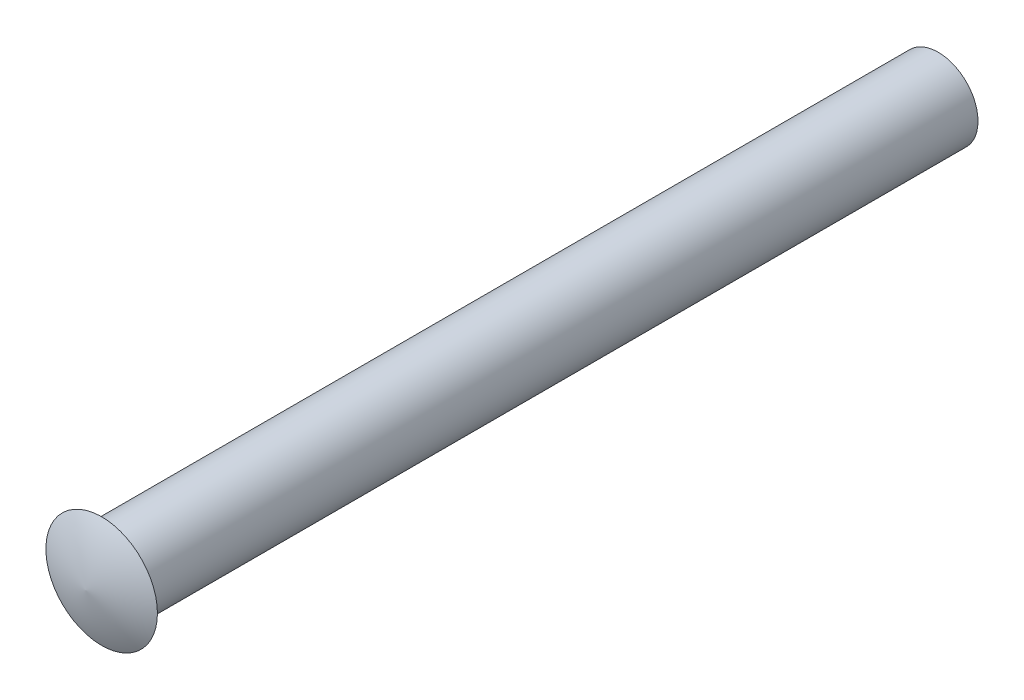
from build123d import *


with BuildPart() as part:
    # Sketch2 → Revolve1 (revolve)
    with BuildSketch(Plane(origin=(0, 0, 0), x_dir=(0, 0, -1), z_dir=(1, 0, 0)), mode=Mode.PRIVATE) as revolve1_sk:
        with BuildLine():
            Line((0.1, 0.35), (0.1, 0.25))
            Line((0.1, 0.25), (5.35, 0.25))
            Line((5.35, 0.25), (5.35, 0))
            Line((5.35, 0), (0, 0))
            ThreePointArc((0, 0), (0.033940648, 0.179588386), (0.1, 0.35))
        make_face()
    revolve(revolve1_sk.sketch.rotate(Axis((0, 0, 0), (0, 0, -1)), 90), axis=Axis((0, 0, 0), (0, 0, -1)))


solid = part.part
